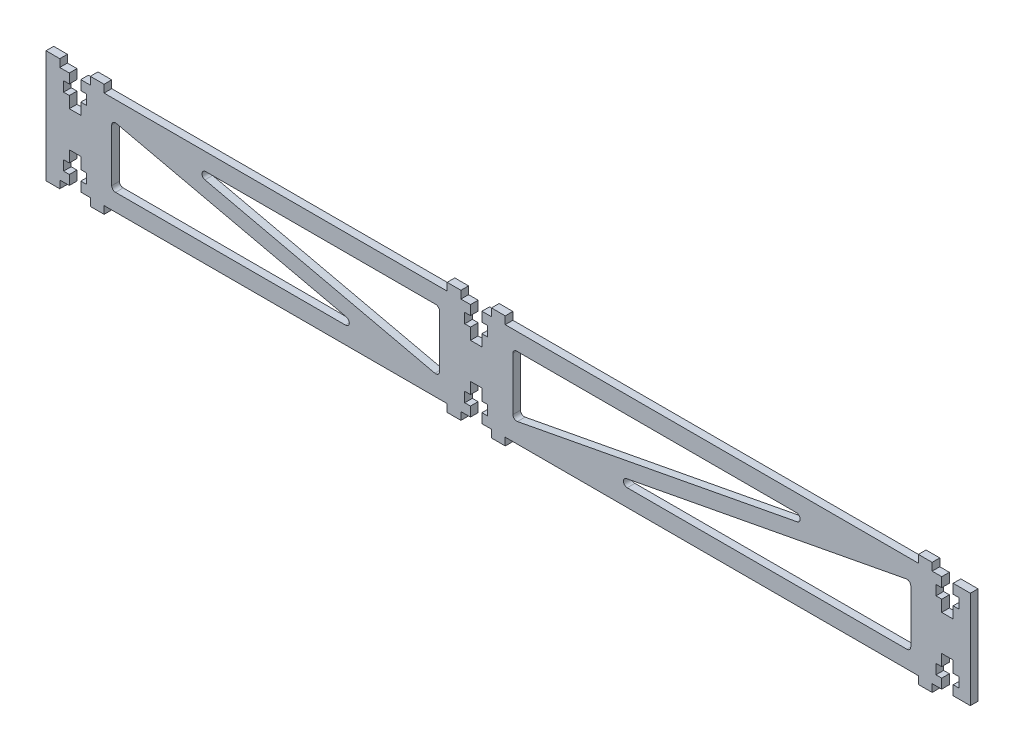
from build123d import *

# Parameters (mm, degrees)
EXTRUDE_1_DEPTH = 2


with BuildPart() as part:
    # 草图2 → 凸台-拉伸1 (new body)
    with BuildSketch(Plane.XY):
        Polygon((-24.246895077, 6.357612039), (-21.746895077, 6.357612039), (-21.746895077, 8.357612039), (-18.146895077, 8.357612039), (-18.146895077, 6.357612039), (71.653104923, 6.357612039), (71.653104923, 8.357612039), (75.253104923, 8.357612039), (75.253104923, 6.357612039), (77.753104923, 6.357612039), (77.753104923, 3.857612039), (76.253104923, 3.857612039), (76.253104923, 1.257612039), (77.753104923, 1.257612039), (77.753104923, -1.742387961), (80.753104923, -1.742387961), (80.753104923, 1.257612039), (82.253104923, 1.257612039), (82.253104923, 3.857612039), (80.753104923, 3.857612039), (80.753104923, 6.357612039), (83.253104923, 6.357612039), (83.253104923, 8.357612039), (86.853104923, 8.357612039), (86.853104923, 6.357612039), (194.993104923, 6.357612039), (194.993104923, 8.357612039), (198.593104923, 8.357612039), (198.593104923, 6.357612039), (201.093104923, 6.357612039), (201.093104923, 3.857612039), (199.593104923, 3.857612039), (199.593104923, 1.257612039), (201.093104923, 1.257612039), (201.093104923, -1.742387961), (204.093104923, -1.742387961), (204.093104923, 1.257612039), (205.593104923, 1.257612039), (205.593104923, 3.857612039), (204.093104923, 3.857612039), (204.093104923, 6.357612039), (206.593104923, 6.357612039), (208.593104923, 6.357612039), (208.593104923, -19.142387961), (206.593104923, -19.142387961), (204.093104923, -19.142387961), (204.093104923, -16.642387961), (205.593104923, -16.642387961), (205.593104923, -14.042387961), (204.093104923, -14.042387961), (204.093104923, -11.042387961), (201.093104923, -11.042387961), (201.093104923, -14.042387961), (199.593104923, -14.042387961), (199.593104923, -16.642387961), (201.093104923, -16.642387961), (201.093104923, -19.142387961), (198.593104923, -19.142387961), (198.593104923, -21.142387961), (194.993104923, -21.142387961), (194.993104923, -19.142387961), (86.853104923, -19.142387961), (86.853104923, -21.142387961), (83.253104923, -21.142387961), (83.253104923, -19.142387961), (80.753104923, -19.142387961), (80.753104923, -16.642387961), (82.253104923, -16.642387961), (82.253104923, -14.042387961), (80.753104923, -14.042387961), (80.753104923, -11.042387961), (77.753104923, -11.042387961), (77.753104923, -14.042387961), (76.253104923, -14.042387961), (76.253104923, -16.642387961), (77.753104923, -16.642387961), (77.753104923, -19.142387961), (75.253104923, -19.142387961), (75.253104923, -21.142387961), (71.653104923, -21.142387961), (71.653104923, -19.142387961), (-18.146895077, -19.142387961), (-18.146895077, -21.142387961), (-21.746895077, -21.142387961), (-21.746895077, -19.142387961), (-24.246895077, -19.142387961), (-24.246895077, -16.642387961), (-22.746895077, -16.642387961), (-22.746895077, -14.042387961), (-24.246895077, -14.042387961), (-24.246895077, -11.042387961), (-27.246895077, -11.042387961), (-27.246895077, -14.042387961), (-28.746895077, -14.042387961), (-28.746895077, -16.642387961), (-27.246895077, -16.642387961), (-27.246895077, -19.142387961), (-29.746895077, -19.142387961), (-29.746895077, -21.142387961), (-33.346895077, -21.142387961), (-33.346895077, 8.357612039), (-29.746895077, 8.357612039), (-29.746895077, 6.357612039), (-27.246895077, 6.357612039), (-27.246895077, 3.857612039), (-28.746895077, 3.857612039), (-28.746895077, 1.257612039), (-27.246895077, 1.257612039), (-27.246895077, -1.742387961), (-24.246895077, -1.742387961), (-24.246895077, 1.257612039), (-22.746895077, 1.257612039), (-22.746895077, 3.857612039), (-24.246895077, 3.857612039), align=None)
        with BuildLine():
            Line((8.47411064, 1.857612039), (68.653104923, 1.857612039))
            ThreePointArc((68.653104923, 1.857612039), (69.360211704, 1.56471882), (69.653104923, 0.857612039))
            Line((69.653104923, 0.857612039), (69.653104923, -12.880354362))
            ThreePointArc((69.653104923, -12.880354362), (69.276579267, -13.662198172), (68.430545438, -13.855273474))
            Line((68.430545438, -13.855273474), (8.251551154, -0.117307073))
            ThreePointArc((8.251551154, -0.117307073), (7.480400644, 0.969596162), (8.47411064, 1.857612039))
        make_face(mode=Mode.SUBTRACT)
        with BuildLine():
            Line((89.853104923, 1.857612039), (163.060529367, 1.857612039))
            ThreePointArc((163.060529367, 1.857612039), (164.056145258, 0.95114811), (163.246781366, -0.124889968))
            Line((163.246781366, -0.124889968), (90.039356922, -14.002753858))
            ThreePointArc((90.039356922, -14.002753858), (89.215238165, -13.79039859), (88.853104923, -13.020251852))
            Line((88.853104923, -13.020251852), (88.853104923, 0.857612039))
            ThreePointArc((88.853104923, 0.857612039), (89.145998142, 1.56471882), (89.853104923, 1.857612039))
        make_face(mode=Mode.SUBTRACT)
        with BuildLine():
            Line((118.785680479, -14.642387961), (191.993104923, -14.642387961))
            ThreePointArc((191.993104923, -14.642387961), (192.700211704, -14.349494742), (192.993104923, -13.642387961))
            Line((192.993104923, -13.642387961), (192.993104923, 0.235475929))
            ThreePointArc((192.993104923, 0.235475929), (192.630971681, 1.005622668), (191.806852924, 1.217977936))
            Line((191.806852924, 1.217977936), (118.599428481, -12.659885955))
            ThreePointArc((118.599428481, -12.659885955), (117.790064588, -13.735924033), (118.785680479, -14.642387961))
        make_face(mode=Mode.SUBTRACT)
        with BuildLine():
            Line((-16.146895077, 0.09557844), (-16.146895077, -13.642387961))
            ThreePointArc((-16.146895077, -13.642387961), (-15.854001858, -14.349494742), (-15.146895077, -14.642387961))
            Line((-15.146895077, -14.642387961), (45.032099206, -14.642387961))
            ThreePointArc((45.032099206, -14.642387961), (46.025809202, -13.754372085), (45.254658692, -12.667468849))
            Line((45.254658692, -12.667468849), (-14.924335591, 1.070497552))
            ThreePointArc((-14.924335591, 1.070497552), (-15.770369421, 0.877422249), (-16.146895077, 0.09557844))
        make_face(mode=Mode.SUBTRACT)
    extrude(amount=EXTRUDE_1_DEPTH)


solid = part.part
